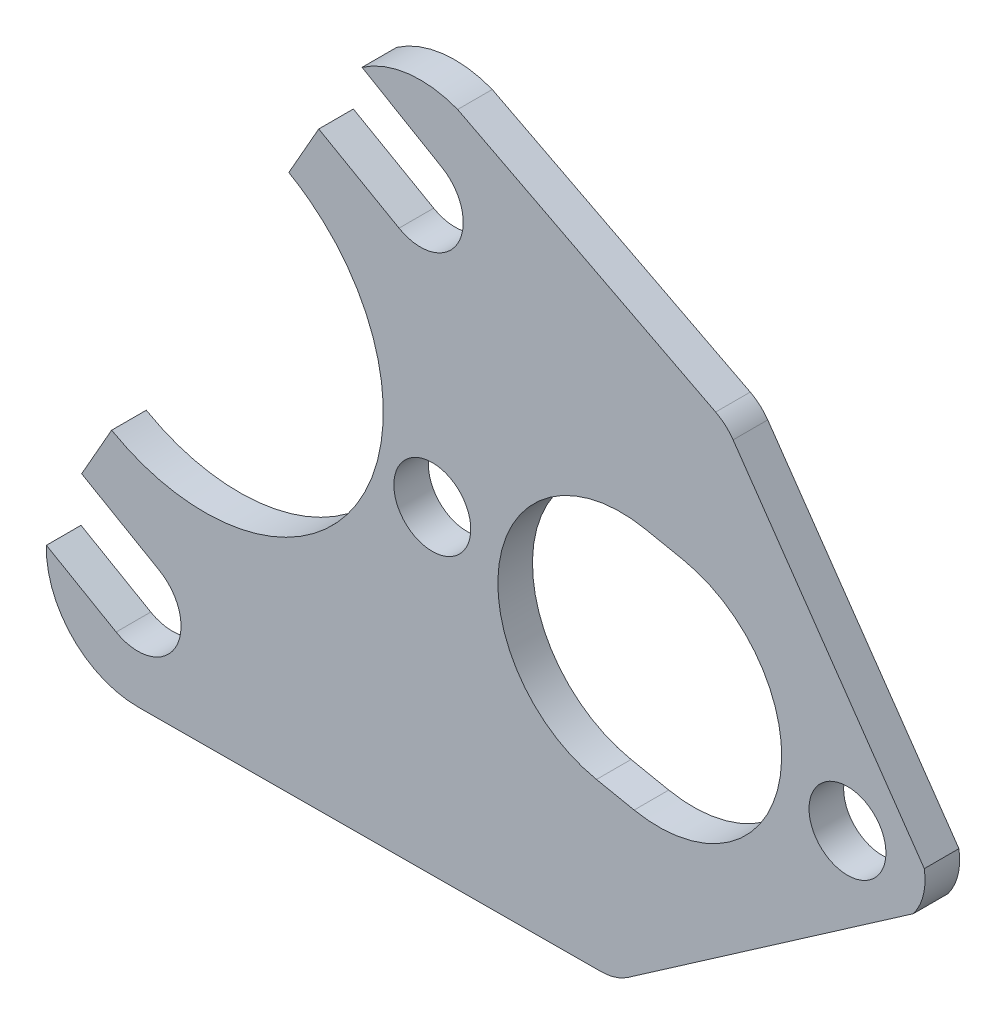
from build123d import *

# Parameters (mm, degrees)
BOSS_EXTRUDE1_DEPTH = 3.6
CUT_EXTRUDE1_DEPTH  = 10
BOSS_EXTRUDE2_DEPTH = 3.6
FILLET2_R           = 5
FILLET3_R           = 5
CUT_EXTRUDE4_DEPTH  = 10
SKETCH5_R           = 4
CUT_EXTRUDE5_DEPTH  = 10


with BuildPart() as part:
    # Model → Boss-Extrude1 (new body)
    with BuildSketch(Plane.XY):
        with BuildLine():
            ThreePointArc((50.228535872, 45.395569416), (52.924019536, 38.465315249), (59.782889449, 35.593041144))
            Line((59.782889449, 35.593041144), (113.827054853, 35.866410266))
            Line((113.827054853, 35.866410266), (139.096203594, 35.866410266))
            Line((139.096203594, 35.866410266), (143.174409672, 59.637869067))
            Line((143.174409672, 59.637869067), (92.999499813, 106.036140475))
            ThreePointArc((92.999499813, 106.036140475), (87.882885081, 106.693381362), (83.060832366, 104.860482154))
            Line((83.060832366, 104.860482154), (91.356130692, 100.009349623))
            ThreePointArc((91.356130692, 100.009349623), (92.985626216, 93.927680535), (86.903957127, 92.29818501))
            Line((86.903957127, 92.29818501), (78.555180285, 97.056247849))
            Line((78.555180285, 97.056247849), (75.4400478, 91.575203017))
            add(Edge.make_bspline(
                [(57.012133278, 59.151469471), (73.67768742, 49.679660596), (82.891644681, 65.891527369), (92.105601941, 82.103394142), (75.4400478, 91.575203017)],
                knots=[4.71238898, 4.71238898, 4.71238898, 6.283185307, 6.283185307, 7.853981634, 7.853981634, 7.853981634], degree=2, weights=[1, 0.707106781, 1, 0.707106781, 1]))
            Line((57.012133278, 59.151469471), (53.897000793, 53.67042464))
            Line((53.897000793, 53.67042464), (61.984810396, 49.000227317))
            ThreePointArc((61.984810396, 49.000227318), (63.628806933, 42.852421177), (57.481000793, 41.20842464))
            Line((57.481000793, 41.20842464), (50.228535872, 45.395569416))
        make_face()
        with BuildLine():
            ThreePointArc((131.161569827, 60.100370477), (130.006797557, 61.990672634), (131.847360572, 63.22317782))
            Line((131.847360572, 63.22317782), (135.786606546, 62.52866997))
            ThreePointArc((135.786606546, 62.52866997), (137.0843143, 60.674111066), (135.228884267, 59.377649136))
            Line((135.228884267, 59.377649136), (131.161569827, 60.100370477))
        make_face(mode=Mode.SUBTRACT)
        with BuildLine():
            Line((88.671682294, 70.836214946), (92.610913304, 70.141622223))
            ThreePointArc((92.610913304, 70.141622223), (93.908768619, 68.288092733), (92.05523913, 66.990237415))
            Line((92.05523913, 66.990237415), (88.116008116, 67.684830138))
            ThreePointArc((88.116008116, 67.684830138), (86.818152801, 69.538359631), (88.671682294, 70.836214946))
        make_face(mode=Mode.SUBTRACT)
        with BuildLine():
            Line((112.523140626, 77.999162994), (116.44350371, 77.204963218))
            ThreePointArc((116.44350371, 77.204963218), (126.447226298, 62.118362064), (111.360625143, 52.114639476))
            Line((111.360625143, 52.114639476), (107.440262059, 52.908839252))
            ThreePointArc((107.440262059, 52.908839252), (97.436539471, 67.995440406), (112.523140626, 77.999162994))
        make_face(mode=Mode.SUBTRACT)
    extrude(amount=BOSS_EXTRUDE1_DEPTH)

    # Sketch1 → Cut-Extrude1 (cut)
    with BuildSketch(Plane(origin=(0, 0, 0), x_dir=(-1, 0, 0), z_dir=(0, 0, -1))):
        Polygon((-111.037360671, 36.937274904), (-140.868549555, 57.620363883), (-151.014711749, 64.655081013), (-139.168658951, 25.748061744), (-100.690846138, 27.008956511), (-96.897067927, 27.133276339), align=None)
    extrude(amount=-CUT_EXTRUDE1_DEPTH, mode=Mode.SUBTRACT)

    # Sketch2 → Boss-Extrude2 (add)
    with BuildSketch(Plane.XY.offset(3.6)):
        Polygon((92.999499813, 106.036140475), (143.024707588, 59.776303156), (141.625060148, 61.795012605), (120.941971169, 91.62620149), align=None)
    extrude(amount=-BOSS_EXTRUDE2_DEPTH)

    # Fillet2
    fillet2_edges = [part.edges().sort_by_distance(p)[0] for p in [
        (109.461001579, 35.844325659, 1.8),
    ]]
    fillet(fillet2_edges, radius=FILLET2_R)

    # Fillet3
    fillet3_edges = [part.edges().sort_by_distance(p)[0] for p in [
        (120.941971169, 91.62620149, 1.8),
    ]]
    fillet(fillet3_edges, radius=FILLET3_R)

    # Sketch4 → Cut-Extrude4 (cut)
    with BuildSketch(Plane(origin=(0, 0, 0), x_dir=(-1, 0, 0), z_dir=(0, 0, -1))):
        with BuildLine():
            Line((-139.736629218, 65.356597838), (-145.722109327, 59.610067808))
            Line((-145.722109327, 59.610067808), (-139.736629218, 56.549346698))
            ThreePointArc((-139.736629218, 56.549346698), (-141.61342704, 60.952972268), (-139.736629218, 65.356597838))
        make_face()
    extrude(amount=-CUT_EXTRUDE4_DEPTH, mode=Mode.SUBTRACT)

    # Sketch5 → Cut-Extrude5 (cut)
    # profile 1 of 2: a face of its own
    with BuildSketch(Plane(origin=(0, 0, 0), x_dir=(-1, 0, 0), z_dir=(0, 0, -1))):
        with Locations((-133.545555928, 61.33239185)):
            Circle(SKETCH5_R)
        with BuildLine():
            ThreePointArc((-135.228884267, 59.377649136), (-137.0843143, 60.674111066), (-135.786606546, 62.52866997))
            Line((-135.786606546, 62.52866997), (-131.847360572, 63.22317782))
            ThreePointArc((-131.847360572, 63.22317782), (-130.006797557, 61.990672634), (-131.161569827, 60.100370477))
            Line((-131.161569827, 60.100370477), (-135.228884267, 59.377649136))
        make_face(mode=Mode.SUBTRACT)
    # profile 2 of 2: a face of its own
    with BuildSketch(Plane(origin=(0, 0, 0), x_dir=(-1, 0, 0), z_dir=(0, 0, -1))):
        with Locations((-90.36346071, 68.913226181)):
            Circle(SKETCH5_R)
    extrude(amount=-CUT_EXTRUDE5_DEPTH, mode=Mode.SUBTRACT)


solid = part.part
